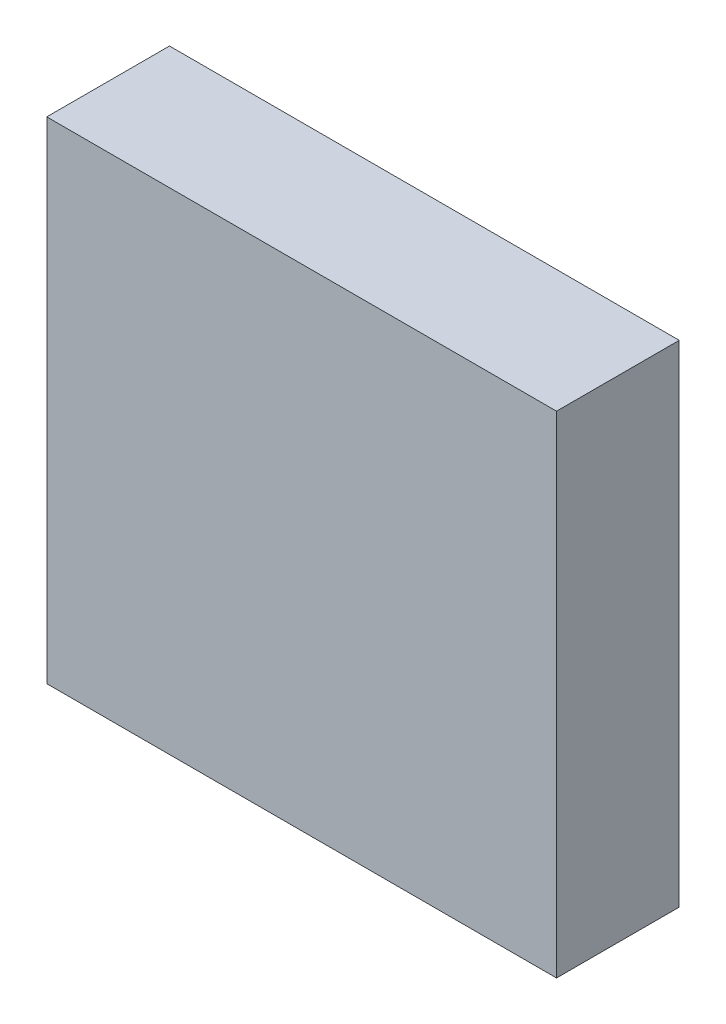
from build123d import *

# Parameters (mm, degrees)
SKETCH1_W           = 27
SKETCH1_H           = 26
BOSS_EXTRUDE1_DEPTH = 3.25


with BuildPart() as part:
    # Sketch1 → Boss-Extrude1 (new, symmetric)
    with BuildSketch(Plane.XY):
        Rectangle(SKETCH1_W, SKETCH1_H)
    extrude(amount=BOSS_EXTRUDE1_DEPTH, both=True)


solid = part.part
